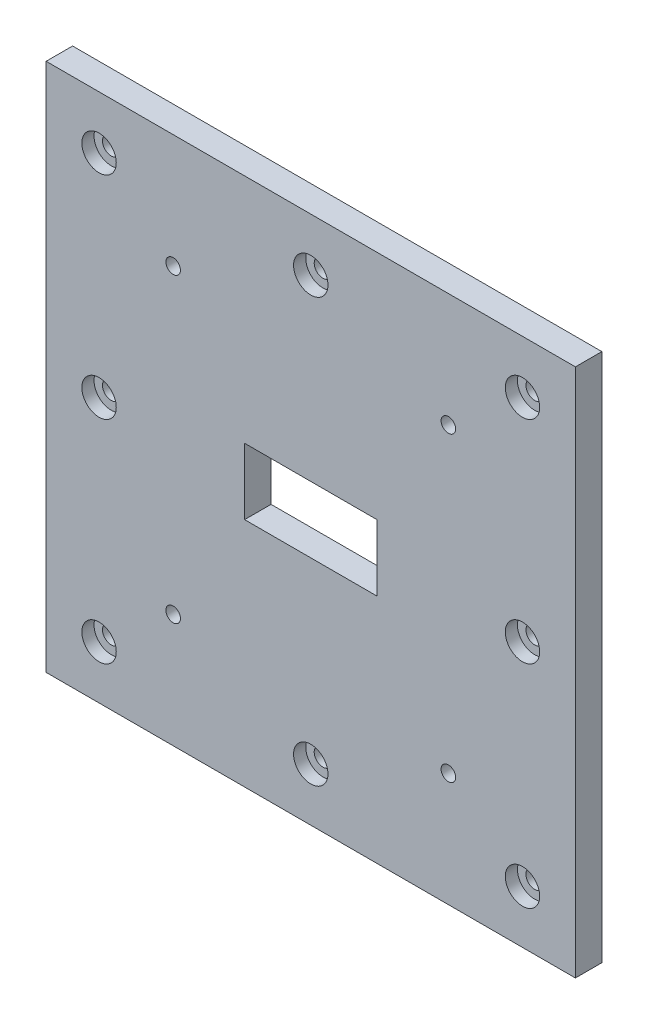
from build123d import *

# Parameters (mm, degrees)
BOSS_EXTRUDE1_DEPTH                                  = 5
BOSS_EXTRUDE1_DEPTH_BACK                             = 5
SKETCH1_W                                            = 200
SKETCH1_H                                            = 200
TAP_DRILL_FOR_M5X0_8_TAP1_D                          = 5
SKETCH5_W                                            = 50
SKETCH5_H                                            = 25
CUT_EXTRUDE2_DEPTH                                   = 20
CBORE_FOR_M6_PAN_HEAD_SCREW1_D                       = 6.6
CBORE_FOR_M6_PAN_HEAD_SCREW1_CBORE_D                 = 13
CBORE_FOR_M6_PAN_HEAD_SCREW1_CBORE_DEPTH             = 4.6
CSK_FOR_M5_HEX_SOCKET_COUNTERSUNK_CAP_SC_D           = 5.5
CSK_FOR_M5_HEX_SOCKET_COUNTERSUNK_CAP_SC_CSINK_D     = 11.2
CSK_FOR_M5_HEX_SOCKET_COUNTERSUNK_CAP_SC_CSINK_ANGLE = 90


with BuildPart() as part:
    # Sketch1 → Boss-Extrude1 (new, two sides: drawn at the far end of the back side and taken through both)
    with BuildSketch(Plane.XY.offset(-BOSS_EXTRUDE1_DEPTH_BACK)):
        Rectangle(SKETCH1_W, SKETCH1_H)
    extrude(amount=BOSS_EXTRUDE1_DEPTH + BOSS_EXTRUDE1_DEPTH_BACK)

    # Tap Drill for M5x0.8 Tap1 (through all)
    with Locations(Plane(origin=(0, 0, -5), x_dir=(-1, 0, 0), z_dir=(0, 0, -1))):
        with Locations((-52, 57), (52, 57), (52, -57), (-52, -57)):
            Hole(TAP_DRILL_FOR_M5X0_8_TAP1_D / 2)

    # Sketch5 → Cut-Extrude2 (cut)
    with BuildSketch(Plane(origin=(0, 0, -5), x_dir=(-1, 0, 0), z_dir=(0, 0, -1))):
        Rectangle(SKETCH5_W, SKETCH5_H)
    extrude(amount=-CUT_EXTRUDE2_DEPTH, mode=Mode.SUBTRACT)

    # CBORE for M6 Pan Head Screw1 (through all)
    with Locations(Plane.XY.offset(5)):
        with Locations((-80, 80), (-80, 0), (-80, -80), (80, 80), (80, 0), (80, -80), (0, 80), (0, -80)):
            CounterBoreHole(CBORE_FOR_M6_PAN_HEAD_SCREW1_D / 2, CBORE_FOR_M6_PAN_HEAD_SCREW1_CBORE_D / 2, CBORE_FOR_M6_PAN_HEAD_SCREW1_CBORE_DEPTH)

    # CSK for M5 Hex Socket Countersunk Cap Screw1 (through all)
    with Locations(Plane(origin=(0, 0, -5), x_dir=(-1, 0, 0), z_dir=(0, 0, -1))):
        with Locations((-52, 57), (52, 57), (52, -57), (-52, -57)):
            CounterSinkHole(CSK_FOR_M5_HEX_SOCKET_COUNTERSUNK_CAP_SC_D / 2, CSK_FOR_M5_HEX_SOCKET_COUNTERSUNK_CAP_SC_CSINK_D / 2, counter_sink_angle=CSK_FOR_M5_HEX_SOCKET_COUNTERSUNK_CAP_SC_CSINK_ANGLE)


solid = part.part
